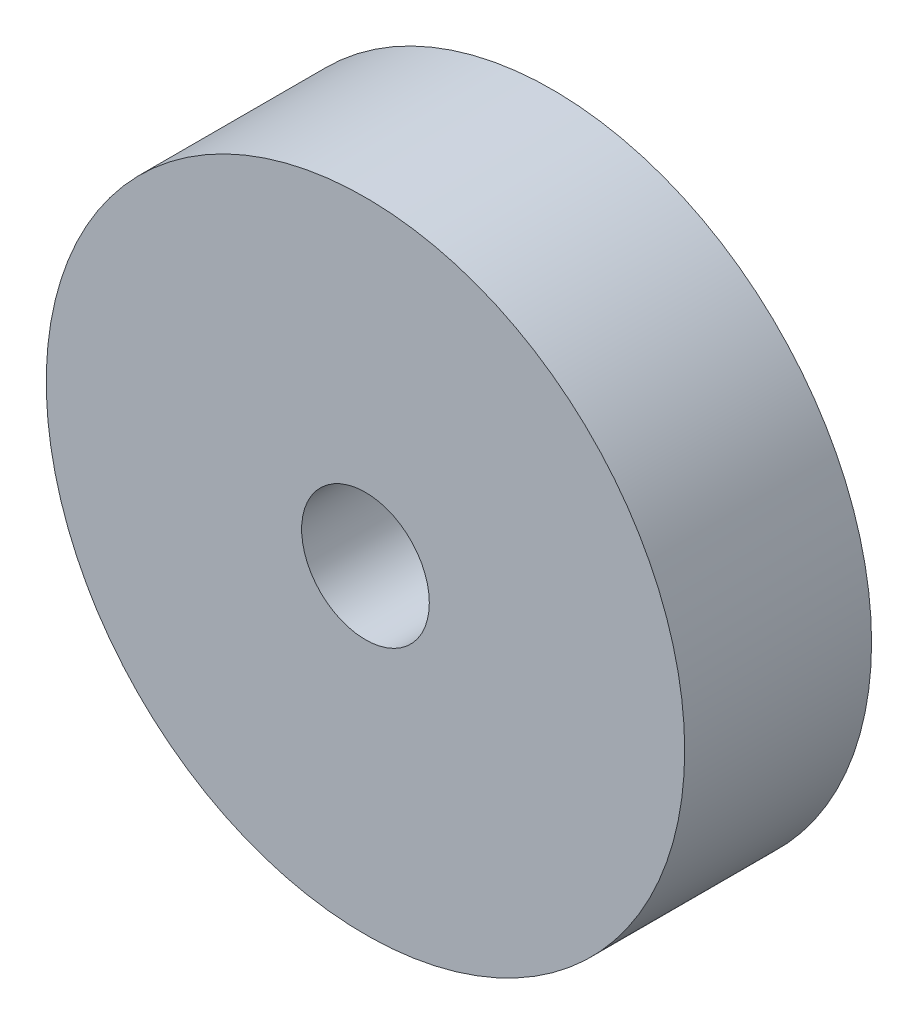
from build123d import *

# Parameters (mm, degrees)
SKETCH_1_R      = 20.5
SKETCH_1_R_2    = 4.1
EXTRUDE_1_DEPTH = 12


with BuildPart() as part:
    # 草图1 → 凸台-拉伸1 (new body)
    with BuildSketch(Plane.XY):
        Circle(SKETCH_1_R)
        Circle(SKETCH_1_R_2, mode=Mode.SUBTRACT)
    extrude(amount=EXTRUDE_1_DEPTH)


solid = part.part
